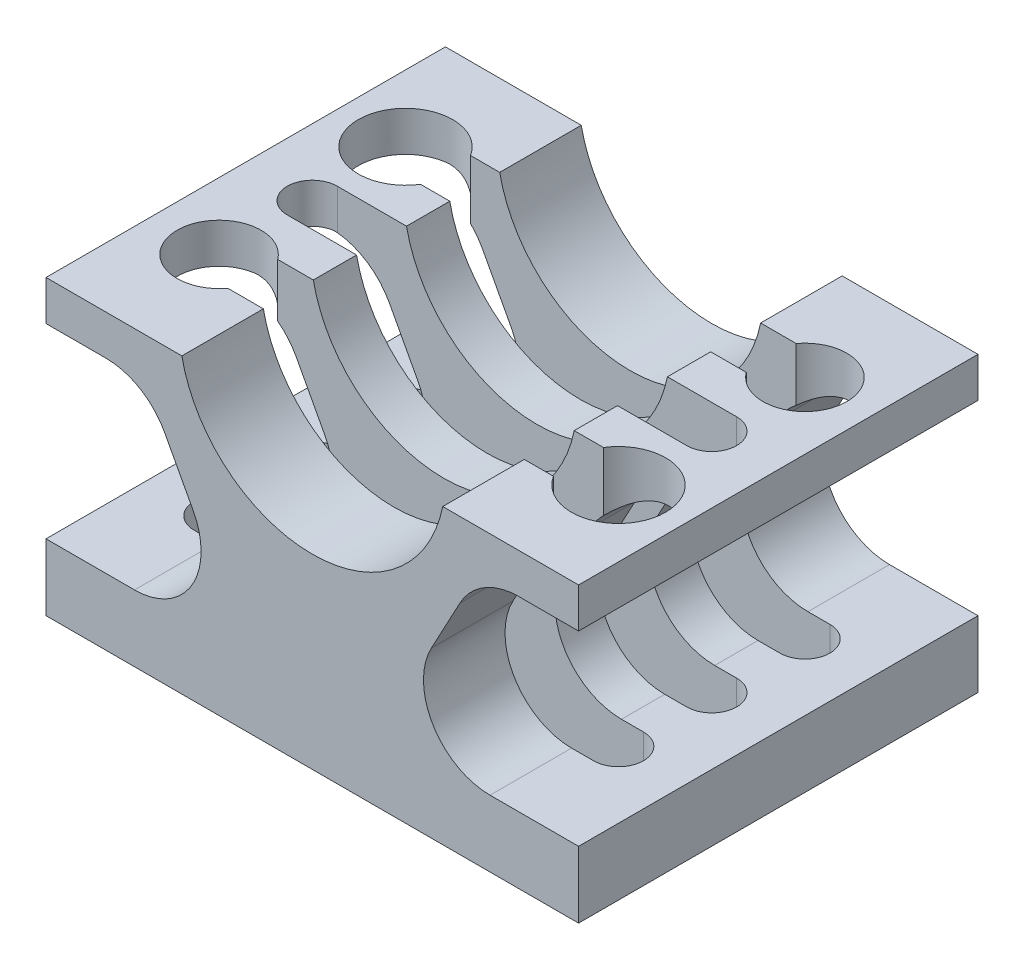
from build123d import *

# Parameters (mm, degrees)
BOSS_EXTRUDE1_DEPTH     = 38.1
CUT_EXTRUDE2_DEPTH      = 71.436357089
FILLET1_R               = 6.35
SKETCH4_W               = 50.8
SKETCH4_H               = 2.54
CUT_EXTRUDE3_DEPTH      = 71.436357187
CUT_EXTRUDE5_DEPTH      = 5.08
CUT_EXTRUDE5_DEPTH_BACK = 25.4
SKETCH5_R               = 4.5
SKETCH5_R_2             = 4


with BuildPart() as part:
    # Sketch1 → Boss-Extrude1 (new body)
    with BuildSketch(Plane.XY):
        with BuildLine():
            Line((38.1, 30.48), (50.8, 30.48))
            Line((50.8, 30.48), (50.8, 24.13))
            Line((50.8, 24.13), (41.275, 24.13))
            Line((41.275, 24.13), (31.75, 6.35))
            Line((31.75, 6.35), (50.8, 6.35))
            Line((50.8, 6.35), (50.8, 0))
            Line((50.8, 0), (0, 0))
            Line((0, 0), (0, 6.35))
            Line((0, 6.35), (19.05, 6.35))
            Line((19.05, 6.35), (9.525, 24.13))
            Line((9.525, 24.13), (0, 24.13))
            Line((0, 24.13), (0, 30.48))
            Line((0, 30.48), (12.7, 30.48))
            ThreePointArc((12.7, 30.48), (25.4, 17.78), (38.1, 30.48))
        make_face()
    extrude(amount=BOSS_EXTRUDE1_DEPTH)

    # Sketch3 → Cut-Extrude2 (cut, through all)
    with BuildSketch(Plane.XZ):
        with BuildLine():
            Line((6.35, 21.43125), (44.45, 21.43125))
            ThreePointArc((44.45, 21.43125), (46.83125, 19.05), (44.45, 16.66875))
            Line((44.45, 16.66875), (6.35, 16.66875))
            ThreePointArc((6.35, 16.66875), (3.96875, 19.05), (6.35, 21.43125))
        make_face()
        with BuildLine():
            Line((6.35, 30.32125), (44.45, 30.32125))
            ThreePointArc((44.45, 30.32125), (46.83125, 27.94), (44.45, 25.55875))
            Line((44.45, 25.55875), (6.35, 25.55875))
            ThreePointArc((6.35, 25.55875), (3.96875, 27.94), (6.35, 30.32125))
        make_face()
        with BuildLine():
            Line((6.35, 12.54125), (44.45, 12.54125))
            ThreePointArc((44.45, 12.54125), (46.83125, 10.16), (44.45, 7.77875))
            Line((44.45, 7.77875), (6.35, 7.77875))
            ThreePointArc((6.35, 7.77875), (3.96875, 10.16), (6.35, 12.54125))
        make_face()
    extrude(amount=-CUT_EXTRUDE2_DEPTH, mode=Mode.SUBTRACT)

    # Fillet1
    fillet1_edges = [part.edges().sort_by_distance(p)[0] for p in [
        (41.275, 24.13, 3.889375),
        (41.275, 24.13, 34.210625),
        (19.05, 6.35, 34.210625),
        (19.05, 6.35, 23.495),
        (19.05, 6.35, 14.605),
        (19.05, 6.35, 3.889375),
        (31.75, 6.35, 34.210625),
        (31.75, 6.35, 23.495),
        (31.75, 6.35, 14.605),
        (31.75, 6.35, 3.889375),
        (9.525, 24.13, 34.210625),
        (9.525, 24.13, 23.495),
        (9.525, 24.13, 14.605),
        (9.525, 24.13, 3.889375),
        (41.275, 24.13, 23.495),
        (41.275, 24.13, 14.605),
    ]]
    fillet(fillet1_edges, radius=FILLET1_R)

    # Sketch4 → Cut-Extrude3 (cut, through all)
    with BuildSketch(Plane.XY.offset(38.1)):
        with Locations((25.4, 29.21)):
            Rectangle(SKETCH4_W, SKETCH4_H)
    extrude(amount=-CUT_EXTRUDE3_DEPTH, mode=Mode.SUBTRACT)

    # Sketch5 → Cut-Extrude5 (cut, two sides: drawn at the far end of the back side and taken through both)
    with BuildSketch(Plane.XZ.offset(-24.13).offset(-CUT_EXTRUDE5_DEPTH_BACK)):
        with Locations((44.45, 27.94)):
            Circle(SKETCH5_R)
        with Locations((6.35, 27.94)):
            Circle(SKETCH5_R_2)
        with Locations((6.35, 10.16)):
            Circle(SKETCH5_R)
        with Locations((44.45, 10.16)):
            Circle(SKETCH5_R_2)
    extrude(amount=CUT_EXTRUDE5_DEPTH + CUT_EXTRUDE5_DEPTH_BACK, mode=Mode.SUBTRACT)


solid = part.part
